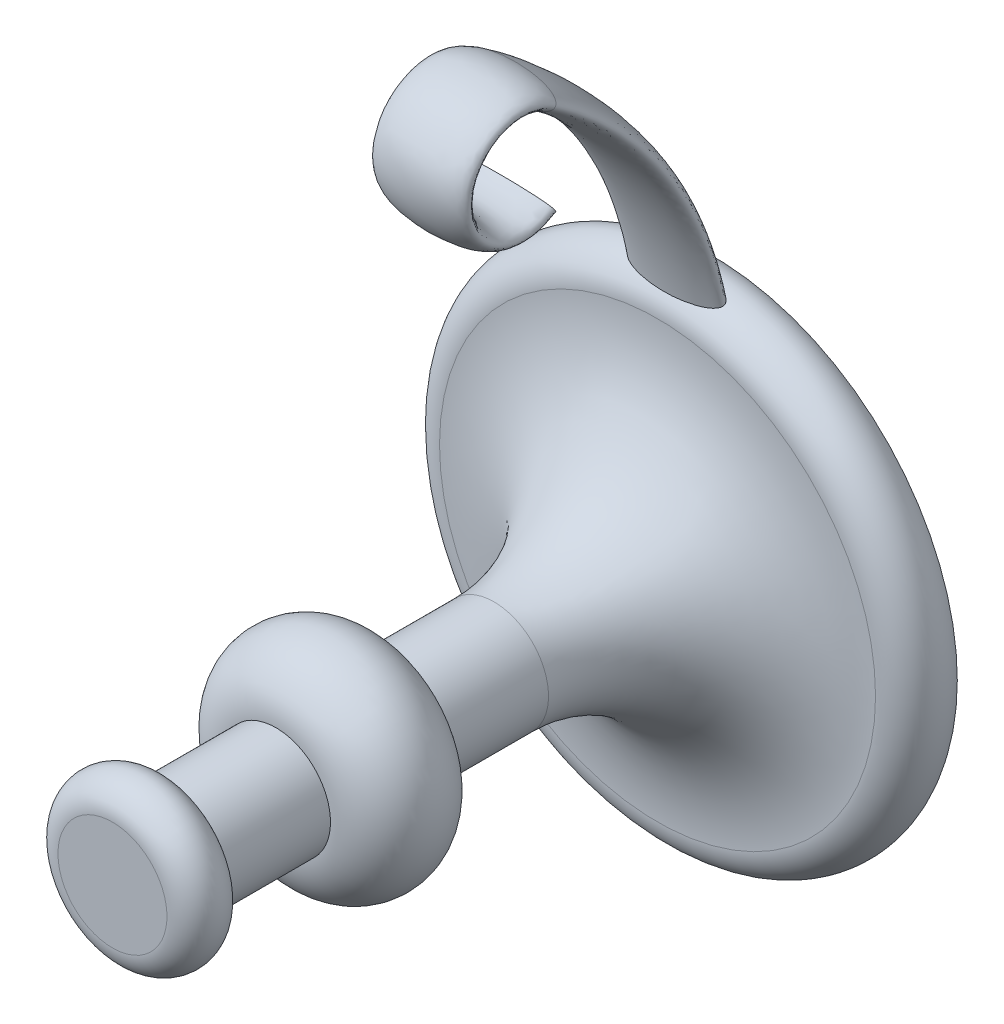
from build123d import *

# Parameters (mm, degrees)
SKIZZE4_RX = 17.5
SKIZZE4_RY = 5


with BuildPart() as part:
    # Skizze1 → Rotation1 (revolve)
    with BuildSketch(Plane.YZ, mode=Mode.PRIVATE) as rotation1_sk:
        with BuildLine():
            Line((0, 0), (0, 220))
            Line((0, 220), (20, 220))
            ThreePointArc((20, 220), (30, 210), (20, 200))
            Line((20, 200), (20, 160))
            ThreePointArc((20, 160), (40, 140), (20, 120))
            Line((20, 120), (20, 80))
            ThreePointArc((20, 80), (37.573593129, 37.573593129), (80, 20))
            ThreePointArc((80, 20), (91.180339887, 13.090169944), (90, 0))
            Line((90, 0), (0, 0))
        make_face()
    revolve(rotation1_sk.sketch.rotate(Axis((0, 0, 0), (0, 0, 1)), 90), axis=Axis((0, 0, 0), (0, 0, 1)))

    # Austragung1: sweep along a path in Skizze2
    with BuildLine(Plane.YZ) as austragung1_path:
        Line((0, 10), (60, 10))
        ThreePointArc((60, 10), (129.821200219, 27.240819526), (183.592070943, 75))
        ThreePointArc((183.592070943, 75), (167.113128151, 106.333333333), (150.634185358, 75))
    # Skizze4 → Austragung1 (sweep)
    with BuildSketch(Plane(origin=(0, 0, 0), x_dir=(-1, 0, 0), z_dir=(0, 1, 0))):
        with Locations((0, 10)):
            Ellipse(SKIZZE4_RX, SKIZZE4_RY)
    sweep(path=austragung1_path.line)


solid = part.part
